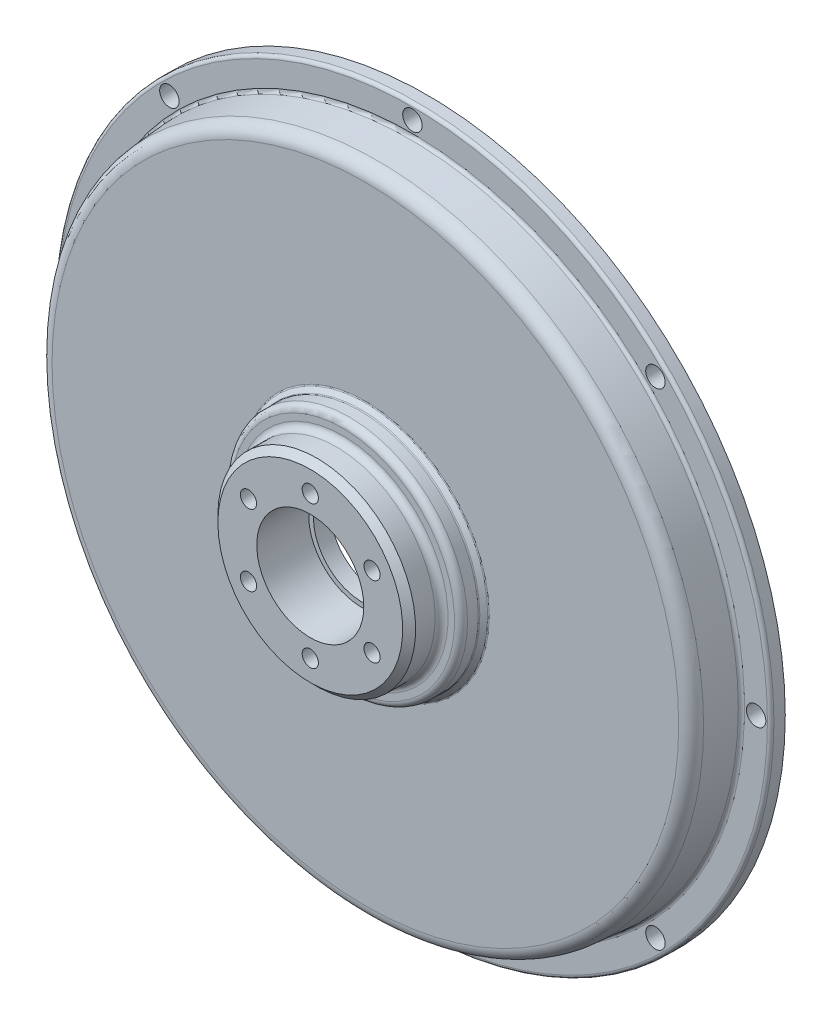
from build123d import *

# Parameters (mm, degrees)
FILLET_1_R          = 0.5
SKETCH_2_R          = 3
CUT_EXTRUDE_1_DEPTH = 10
SKETCH_3_R          = 16.5
CUT_EXTRUDE_2_DEPTH = 16
SKETCH_4_R          = 2.5
CUT_EXTRUDE_3_DEPTH = 15
SKETCH_5_R          = 95
CUT_EXTRUDE_4_DEPTH = 15
SKETCH_6_R          = 15
CUT_EXTRUDE_5_DEPTH = 15


with BuildPart() as part:
    # Эскиз1 → Повернуть1 (revolve)
    with BuildSketch(Plane(origin=(0, 0, 0), x_dir=(1, 0, 0), z_dir=(0, 1, 0))):
        with BuildLine():
            Line((-110.5, 0), (-110.5, -3.5))
            ThreePointArc((-110.5, -3.5), (-110.207106781, -4.207106781), (-109.5, -4.5))
            Line((-109.5, -4.5), (-102.422405257, -4.5))
            ThreePointArc((-102.422405257, -4.5), (-101.744391769, -4.764950538), (-101.425658359, -5.419404578))
            Line((-101.425658359, -5.419404578), (-100.624918852, -15.322381688))
            ThreePointArc((-100.624918852, -15.322381688), (-99.34998521, -17.940197846), (-96.637931261, -19))
            Line((-96.637931261, -19), (-38, -19))
            Line((-38, -19), (-36.5, -20.5))
            Line((-36.5, -20.5), (-36.5, -24))
            ThreePointArc((-36.5, -24), (-35.914213562, -25.414213562), (-34.5, -26))
            Line((-34.5, -26), (-32.5, -26))
            ThreePointArc((-32.5, -26), (-31.085786438, -26.585786438), (-30.5, -28))
            Line((-30.5, -28), (-30.5, -34))
            Line((-30.5, -34), (-28.5, -36))
            Line((-28.5, -36), (0, -36))
            Line((0, -36), (0, 0))
            Line((0, 0), (-110.5, 0))
        make_face()
    revolve(axis=Axis((0, 0, 0), (0, 0, 1)))

    # Скругление1
    fillet_1_edges = [part.edges().sort_by_distance(p)[0] for p in [
        (38, 0, 19),
        (36.5, 0, 20.5),
    ]]
    fillet(fillet_1_edges, radius=FILLET_1_R)

    # Эскиз2 → Вырез-Вытянуть1 (cut)
    with BuildSketch(Plane.XY.offset(4.5)):
        with Locations((0, 106)):
            Circle(SKETCH_2_R)
        with Locations((74.953318806, 74.953318806)):
            Circle(SKETCH_2_R)
        with Locations((106, 0)):
            Circle(SKETCH_2_R)
        with Locations((74.953318806, -74.953318806)):
            Circle(SKETCH_2_R)
        with Locations((0, -106)):
            Circle(SKETCH_2_R)
        with Locations((-74.953318806, -74.953318806)):
            Circle(SKETCH_2_R)
        with Locations((-106, 0)):
            Circle(SKETCH_2_R)
        with Locations((-74.953318806, 74.953318806)):
            Circle(SKETCH_2_R)
    extrude(amount=-CUT_EXTRUDE_1_DEPTH, mode=Mode.SUBTRACT)

    # Эскиз3 → Вырез-Вытянуть2 (cut)
    with BuildSketch(Plane.XY.offset(36)):
        Circle(SKETCH_3_R)
    extrude(amount=-CUT_EXTRUDE_2_DEPTH, mode=Mode.SUBTRACT)

    # Эскиз4 → Вырез-Вытянуть3 (cut)
    with BuildSketch(Plane.XY.offset(36)):
        with Locations((0, 22)):
            Circle(SKETCH_4_R)
        with Locations((19.052558883, 11)):
            Circle(SKETCH_4_R)
        with Locations((19.052558883, -11)):
            Circle(SKETCH_4_R)
        with Locations((0, -22)):
            Circle(SKETCH_4_R)
        with Locations((-19.052558883, -11)):
            Circle(SKETCH_4_R)
        with Locations((-19.052558883, 11)):
            Circle(SKETCH_4_R)
    extrude(amount=-CUT_EXTRUDE_3_DEPTH, mode=Mode.SUBTRACT)

    # Эскиз5 → Вырез-Вытянуть4 (cut)
    with BuildSketch(Plane(origin=(0, 0, 0), x_dir=(-1, 0, 0), z_dir=(0, 0, -1))):
        Circle(SKETCH_5_R)
    extrude(amount=-CUT_EXTRUDE_4_DEPTH, mode=Mode.SUBTRACT)

    # Эскиз6 → Вырез-Вытянуть5 (cut)
    with BuildSketch(Plane.XY.offset(20)):
        Circle(SKETCH_6_R)
    extrude(amount=-CUT_EXTRUDE_5_DEPTH, mode=Mode.SUBTRACT)


solid = part.part
